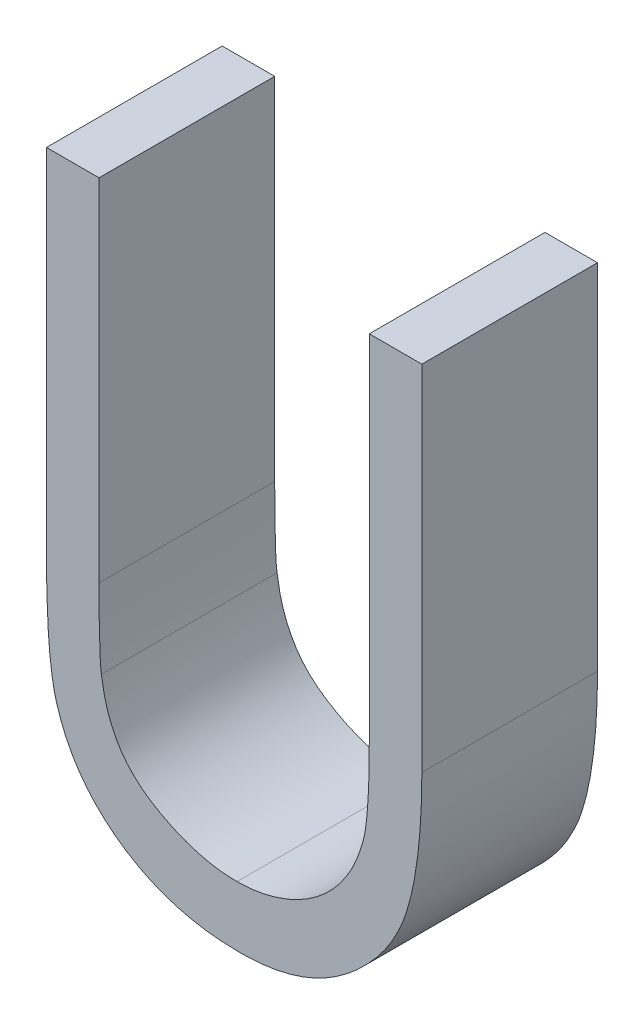
from build123d import *

# Parameters (mm, degrees)
BOSS_EXTRU_1_DEPTH = 1.5


with BuildPart() as part:
    # Esquisse1 → Boss.-Extru.1 (new body)
    with BuildSketch(Plane.XY):
        with BuildLine():
            Line((-55.432465326, -17.870119076), (-54.983747377, -17.870119076))
            Line((-54.983747377, -17.870119076), (-54.983747377, -20.865912345))
            add(Edge.make_bspline(
                [(-54.983747377, -20.865912345), (-54.983814154, -20.908313397), (-54.983940875, -20.988776698), (-54.983094427, -21.103302841), (-54.980723901, -21.20512064), (-54.979229387, -21.294622565), (-54.975904625, -21.371397919), (-54.973193129, -21.435862648), (-54.96970662, -21.487711509), (-54.965516452, -21.517969975), (-54.963715326, -21.530976448)],
                knots=[0, 0, 0, 0, 1.528628734, 2.90083645, 4.128790002, 5.200304208, 6.127813768, 6.898992206, 7.526736466, 8, 8, 8, 8], degree=3))
            add(Edge.make_bspline(
                [(-54.963715326, -21.530976448), (-54.956318956, -21.577900396), (-54.941942976, -21.669104294), (-54.905305293, -21.798973269), (-54.854137435, -21.916018209), (-54.793504516, -22.023891482), (-54.713600786, -22.119590568), (-54.61788145, -22.207750072), (-54.501913209, -22.28485265), (-54.372969487, -22.355353809), (-54.233990576, -22.412018213), (-54.091974481, -22.454865876), (-53.949055939, -22.48097859), (-53.853375704, -22.484002217), (-53.805862762, -22.485503692)],
                knots=[0, 0, 0, 0, 1.035780045, 2.013197591, 2.933192213, 3.817615948, 4.702609284, 5.640816605, 6.646850145, 7.73207398, 8.84249596, 9.914020372, 10.964143139, 12, 12, 12, 12], degree=3))
            add(Edge.make_bspline(
                [(-53.805862762, -22.485503692), (-53.765071704, -22.48396962), (-53.683725187, -22.480910337), (-53.562858858, -22.461965435), (-53.445144417, -22.42782177), (-53.330000588, -22.383764972), (-53.22207061, -22.325554128), (-53.121294265, -22.258310071), (-53.031345787, -22.179437391), (-52.949262933, -22.092151185), (-52.877784453, -21.993665756), (-52.81582568, -21.886125559), (-52.765074352, -21.767912206), (-52.740012173, -21.68483446), (-52.7271368, -21.642154333)],
                knots=[0, 0, 0, 0, 0.994687771, 1.983630487, 2.973142513, 3.978332533, 4.983357753, 5.956394766, 6.925816176, 7.893390482, 8.871859704, 9.88551698, 10.913711441, 12, 12, 12, 12], degree=3))
            add(Edge.make_bspline(
                [(-52.7271368, -21.642154333), (-52.722850907, -21.624513512), (-52.71330021, -21.585202655), (-52.70437586, -21.518743668), (-52.695080823, -21.440330291), (-52.688631438, -21.34939913), (-52.68234398, -21.246254884), (-52.678582447, -21.13036023), (-52.676843829, -21.002136), (-52.676325714, -20.912654341), (-52.676055069, -20.865912345)],
                knots=[0, 0, 0, 0, 0.558680831, 1.244966039, 2.062412453, 2.990489873, 4.051219941, 5.244515665, 6.560634259, 8, 8, 8, 8], degree=3))
            Line((-52.676055069, -20.865912345), (-52.676055069, -17.870119076))
            Line((-52.676055069, -17.870119076), (-52.227337121, -17.870119076))
            Line((-52.227337121, -17.870119076), (-52.227337121, -20.889950807))
            add(Edge.make_bspline(
                [(-52.227337121, -20.889950807), (-52.22770015, -20.944377063), (-52.228408623, -21.05059321), (-52.234552304, -21.206238008), (-52.244348018, -21.353885124), (-52.258188144, -21.493554405), (-52.27652672, -21.624746061), (-52.296919892, -21.748610016), (-52.322890653, -21.864257148), (-52.353224084, -21.972589173), (-52.387900581, -22.075711335), (-52.432816507, -22.173580785), (-52.483422935, -22.269172784), (-52.543443868, -22.361041511), (-52.610888701, -22.44959373), (-52.687248244, -22.534292409), (-52.769997046, -22.616491046), (-52.860510702, -22.694081141), (-52.957297167, -22.765236393), (-53.060068535, -22.827804638), (-53.168035349, -22.88069552), (-53.280916958, -22.924232555), (-53.398761533, -22.956967696), (-53.521572047, -22.981360776), (-53.649628038, -22.995221201), (-53.736720404, -22.997281101), (-53.780822698, -22.998324204)],
                knots=[0, 0, 0, 0, 1.316592851, 2.569410997, 3.76748051, 4.895814652, 5.963796859, 6.97159953, 7.931736103, 8.829262218, 9.692595152, 10.560224239, 11.431080259, 12.30701507, 13.211635791, 14.121146779, 15.063487852, 16.031507147, 17.00238618, 17.966455255, 18.938106653, 19.907068911, 20.888905087, 21.893141452, 22.933117798, 24, 24, 24, 24], degree=3))
            add(Edge.make_bspline(
                [(-53.780822698, -22.998324204), (-53.828921416, -22.997203111), (-53.923290928, -22.99500353), (-54.06234531, -22.982399602), (-54.195651305, -22.958659038), (-54.324616844, -22.928430547), (-54.447486125, -22.886739494), (-54.565905331, -22.838027887), (-54.677846304, -22.778203229), (-54.78512506, -22.711641239), (-54.884874711, -22.636748899), (-54.97644243, -22.555120079), (-55.059979388, -22.468062397), (-55.134077526, -22.374633303), (-55.199964504, -22.275559436), (-55.256721951, -22.170560522), (-55.305455157, -22.059677213), (-55.330607396, -21.982601213), (-55.343322698, -21.943636704)],
                knots=[0, 0, 0, 0, 1.13879206, 2.234305948, 3.301075583, 4.341971843, 5.366689343, 6.369221514, 7.369726634, 8.367512178, 9.355451585, 10.318319045, 11.268648973, 12.207971039, 13.137398894, 14.081662264, 15.030215811, 16, 16, 16, 16], degree=3))
            add(Edge.make_bspline(
                [(-55.343322698, -21.943636704), (-55.350718638, -21.917018741), (-55.366760597, -21.859283785), (-55.383939594, -21.763731659), (-55.398381139, -21.653710348), (-55.411960508, -21.529212322), (-55.419973305, -21.390141084), (-55.426998217, -21.236556918), (-55.432514816, -21.068274116), (-55.432482284, -20.951053379), (-55.432465326, -20.889950807)],
                knots=[0, 0, 0, 0, 0.625038921, 1.35572334, 2.194682327, 3.136881307, 4.189498639, 5.346923369, 6.617055217, 8, 8, 8, 8], degree=3))
            Line((-55.432465326, -20.889950807), (-55.432465326, -17.870119076))
        make_face()
    extrude(amount=BOSS_EXTRU_1_DEPTH)


solid = part.part
